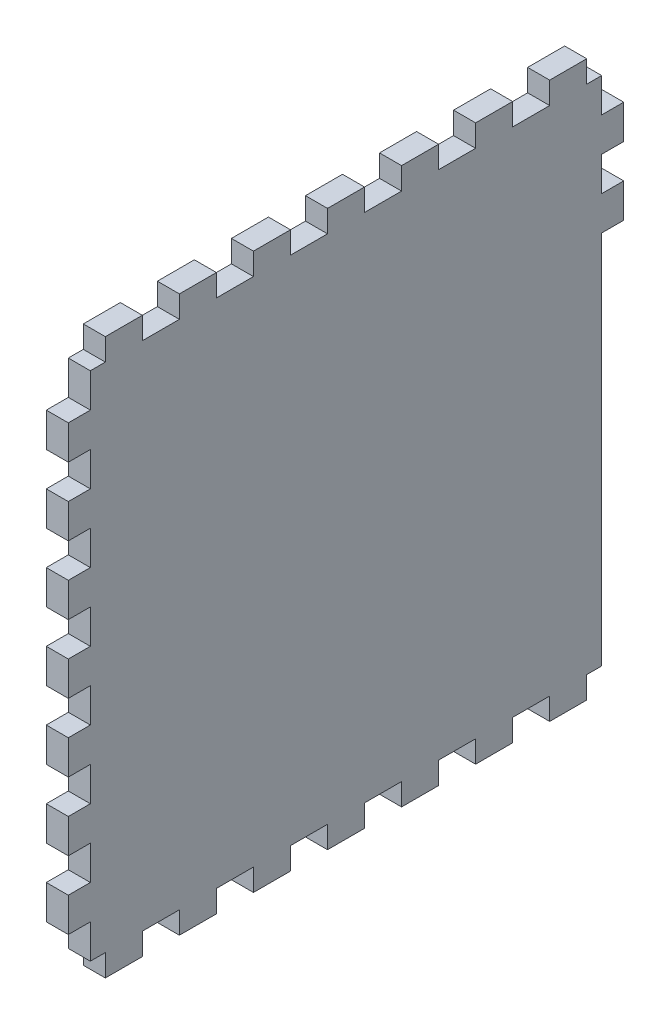
from build123d import *

# Parameters (mm, degrees)
SKETCH2_W           = 80
SKETCH2_H           = 80
BOSS_EXTRUDE1_DEPTH = 3.175
SKETCH3_OUTSIDE_W   = 104.636
SKETCH3_OUTSIDE_H   = 104.636
CUT_EXTRUDE1_DEPTH  = 57.657573413
SKETCH4_W           = 3.175
SKETCH4_H           = 49.1
CUT_EXTRUDE2_DEPTH  = 57.657573413


with BuildPart() as part:
    # Sketch2 → Boss-Extrude1 (new body)
    with BuildSketch(Plane(origin=(0, 0, 0), x_dir=(0, 0, -1), z_dir=(1, 0, 0))):
        Rectangle(SKETCH2_W, SKETCH2_H)
    extrude(amount=BOSS_EXTRUDE1_DEPTH)

    # Sketch3 outside → Cut-Extrude1 (cut, through all)
    with BuildSketch(Plane(origin=(3.175, 0, 0), x_dir=(0, 0, -1), z_dir=(1, 0, 0))):
        Rectangle(SKETCH3_OUTSIDE_W, SKETCH3_OUTSIDE_H)
        Polygon((34.666666667, 36.825), (36.825, 36.825), (36.825, 31.915), (40, 31.915), (40, 27.005), (36.825, 27.005), (36.825, 22.095), (40, 22.095), (40, 17.185), (36.825, 17.185), (36.825, 12.275), (40, 12.275), (40, 7.365), (36.825, 7.365), (36.825, 2.455), (40, 2.455), (40, -2.455), (36.825, -2.455), (36.825, -7.365), (40, -7.365), (40, -12.275), (36.825, -12.275), (36.825, -17.185), (40, -17.185), (40, -22.095), (36.825, -22.095), (36.825, -27.005), (40, -27.005), (40, -31.915), (36.825, -31.915), (36.825, -36.825), (34.666666667, -36.825), (34.666666667, -40), (29.333333333, -40), (29.333333333, -36.825), (24, -36.825), (24, -40), (18.666666667, -40), (18.666666667, -36.825), (13.333333333, -36.825), (13.333333333, -40), (8, -40), (8, -36.825), (2.666666667, -36.825), (2.666666667, -40), (-2.666666667, -40), (-2.666666667, -36.825), (-8, -36.825), (-8, -40), (-13.333333333, -40), (-13.333333333, -36.825), (-18.666666667, -36.825), (-18.666666667, -40), (-24, -40), (-24, -36.825), (-29.333333333, -36.825), (-29.333333333, -40), (-34.666666667, -40), (-34.666666667, -36.825), (-36.825, -36.825), (-36.825, -31.915), (-40, -31.915), (-40, -27.005), (-36.825, -27.005), (-36.825, -22.095), (-40, -22.095), (-40, -17.185), (-36.825, -17.185), (-36.825, -12.275), (-40, -12.275), (-40, -7.365), (-36.825, -7.365), (-36.825, -2.455), (-40, -2.455), (-40, 2.455), (-36.825, 2.455), (-36.825, 7.365), (-40, 7.365), (-40, 12.275), (-36.825, 12.275), (-36.825, 17.185), (-40, 17.185), (-40, 22.095), (-36.825, 22.095), (-36.825, 27.005), (-40, 27.005), (-40, 31.915), (-36.825, 31.915), (-36.825, 36.825), (-34.666666667, 36.825), (-34.666666667, 40), (-29.333333333, 40), (-29.333333333, 36.825), (-24, 36.825), (-24, 40), (-18.666666667, 40), (-18.666666667, 36.825), (-13.333333333, 36.825), (-13.333333333, 40), (-8, 40), (-8, 36.825), (-2.666666667, 36.825), (-2.666666667, 40), (2.666666667, 40), (2.666666667, 36.825), (8, 36.825), (8, 40), (13.333333333, 40), (13.333333333, 36.825), (18.666666667, 36.825), (18.666666667, 40), (24, 40), (24, 36.825), (29.333333333, 36.825), (29.333333333, 40), (34.666666667, 40), align=None, mode=Mode.SUBTRACT)
    extrude(amount=-CUT_EXTRUDE1_DEPTH, mode=Mode.SUBTRACT)

    # Sketch4 → Cut-Extrude2 (cut, through all)
    with BuildSketch(Plane(origin=(3.175, 0, 0), x_dir=(0, 0, -1), z_dir=(1, 0, 0))):
        with Locations((38.4125, -12.275)):
            Rectangle(SKETCH4_W, SKETCH4_H)
    extrude(amount=-CUT_EXTRUDE2_DEPTH, mode=Mode.SUBTRACT)


solid = part.part
